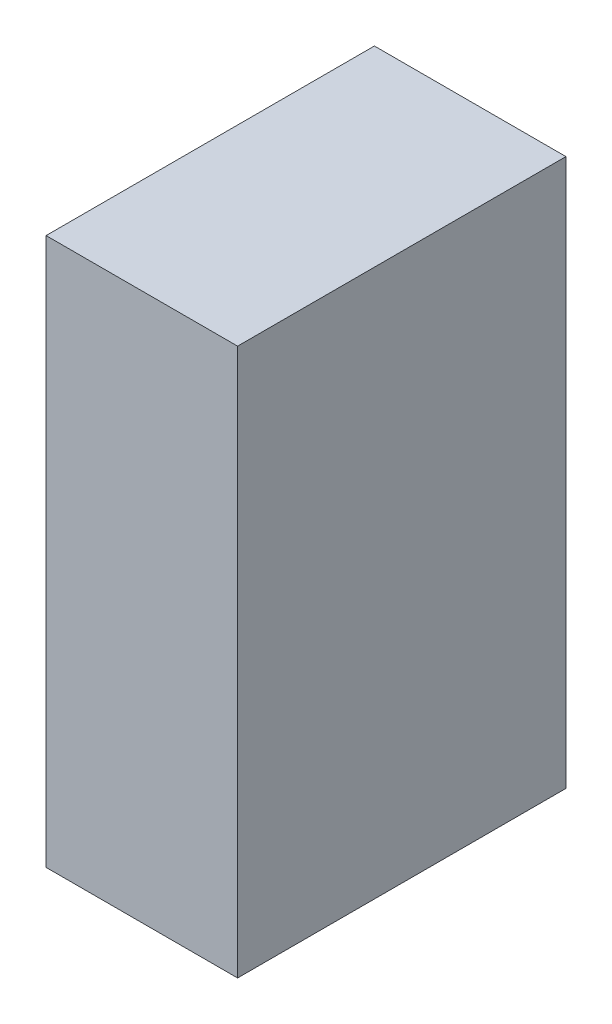
from build123d import *

# Parameters (mm, degrees)
PACK_PANO_SERVO_SURUCU_1_1_START = -188
SKETCH1_W                        = 35
SKETCH1_H                        = 100
PACK_PANO_SERVO_SURUCU_1_1_DEPTH = 60


with BuildPart() as part:
    # Sketch1 → PACK_pano_servo_surucu_1_1 (new body)
    with BuildSketch(Plane.XY.offset(PACK_PANO_SERVO_SURUCU_1_1_START)):
        with Locations((537.5, 230)):
            Rectangle(SKETCH1_W, SKETCH1_H)
    extrude(amount=-PACK_PANO_SERVO_SURUCU_1_1_DEPTH)


solid = part.part
